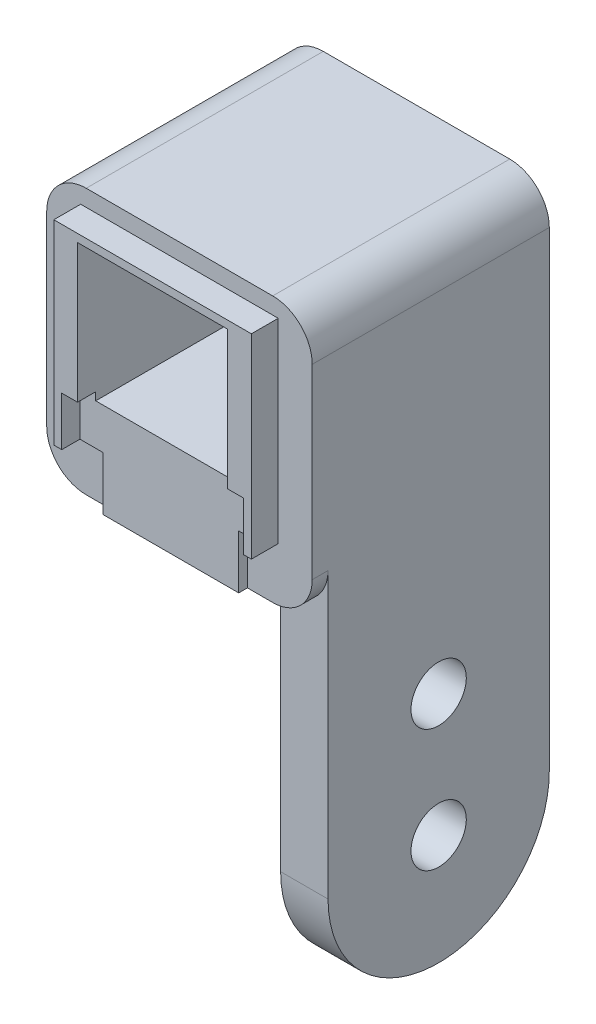
from build123d import *

# Parameters (mm, degrees)
SKETCH1_W           = 25
SKETCH1_H           = 24.7
SKETCH1_W_2         = 19
SKETCH1_H_2         = 18.5
BOSS_EXTRUDE1_DEPTH = 3.4
SKETCH1_3_W         = 33.6
SKETCH1_3_H         = 33.6
SKETCH1_3_W_2       = 19
SKETCH1_3_H_2       = 18.5
BOSS_EXTRUDE2_DEPTH = 27
SKETCH2_W           = 33.6
SKETCH2_H           = 33.6
BOSS_EXTRUDE3_DEPTH = 3
SKETCH3_R           = 3.5
BOSS_EXTRUDE4_DEPTH = 6
FILLET1_R           = 5
SKETCH4_W           = 18
SKETCH4_H           = 5.2
CUT_EXTRUDE1_DEPTH  = 2.3
SKETCH5_W           = 17.2
SKETCH5_H           = 6.8
BOSS_EXTRUDE5_DEPTH = 1.1
SKETCH6_W           = 25
SKETCH6_H           = 6.2
CUT_EXTRUDE2_DEPTH  = 2.3
SKETCH7_W           = 1
SKETCH7_H           = 2.3
BOSS_EXTRUDE6_DEPTH = 6.2


with BuildPart() as part:
    # Sketch1 → Boss-Extrude1 (new body)
    with BuildSketch(Plane.XY):
        with Locations((0.492069479, 3.229581152)):
            Rectangle(SKETCH1_W, SKETCH1_H)
        with Locations((0.492069479, 5.329581152)):
            Rectangle(SKETCH1_W_2, SKETCH1_H_2, mode=Mode.SUBTRACT)
    extrude(amount=BOSS_EXTRUDE1_DEPTH)

    # Sketch1<3> → Boss-Extrude2 (add)
    with BuildSketch(Plane.XY):
        with Locations((0.492069479, 0.879581152)):
            Rectangle(SKETCH1_3_W, SKETCH1_3_H)
        with Locations((0.492069479, 5.329581152)):
            Rectangle(SKETCH1_3_W_2, SKETCH1_3_H_2, mode=Mode.SUBTRACT)
    extrude(amount=-BOSS_EXTRUDE2_DEPTH)

    # Sketch2 → Boss-Extrude3 (add)
    with BuildSketch(Plane(origin=(0, 0, -27), x_dir=(-1, 0, 0), z_dir=(0, 0, -1))):
        with Locations((-0.492069479, 0.879581152)):
            Rectangle(SKETCH2_W, SKETCH2_H)
    extrude(amount=BOSS_EXTRUDE3_DEPTH)

    # Sketch3 → Boss-Extrude4 (add)
    with BuildSketch(Plane(origin=(17.292069479, 0, 0), x_dir=(0, 0, -1), z_dir=(1, 0, 0))):
        with BuildLine():
            Line((30, -46.920418848), (30, -15.920418848))
            Line((30, -15.920418848), (2, -15.920418848))
            Line((2, -15.920418848), (2, -46.920418848))
            ThreePointArc((2, -46.920418848), (16, -60.920418848), (30, -46.920418848))
        make_face()
        with Locations((16, -46.920418848)):
            Circle(SKETCH3_R, mode=Mode.SUBTRACT)
        with Locations((16, -31.420418848)):
            Circle(SKETCH3_R, mode=Mode.SUBTRACT)
    extrude(amount=-BOSS_EXTRUDE4_DEPTH)

    # Fillet1
    fillet1_edges = [part.edges().sort_by_distance(p)[0] for p in [
        (17.292069479, -15.920418848, -1),
        (-16.307930521, -15.920418848, -15),
        (17.292069479, 17.679581152, -15),
        (-16.307930521, 17.679581152, -15),
    ]]
    fillet(fillet1_edges, radius=FILLET1_R)

    # Sketch4 → Cut-Extrude1 (cut)
    with BuildSketch(Plane.XY.offset(3.4)):
        with Locations((0.492069479, -6.520418848)):
            Rectangle(SKETCH4_W, SKETCH4_H)
    extrude(amount=-CUT_EXTRUDE1_DEPTH, mode=Mode.SUBTRACT)

    # Sketch5 → Boss-Extrude5 (add)
    with BuildSketch(Plane.XY):
        with Locations((0.492069479, -12.520418848)):
            Rectangle(SKETCH5_W, SKETCH5_H)
    extrude(amount=BOSS_EXTRUDE5_DEPTH)

    # Sketch6 → Cut-Extrude2 (cut)
    with BuildSketch(Plane.XY.offset(3.4)):
        with Locations((0.492069479, -6.020418848)):
            Rectangle(SKETCH6_W, SKETCH6_H)
    extrude(amount=-CUT_EXTRUDE2_DEPTH, mode=Mode.SUBTRACT)

    # Sketch7 → Boss-Extrude6 (add)
    with BuildSketch(Plane.XZ.offset(2.920418848)):
        with Locations((-11.507930521, 2.25)):
            Rectangle(SKETCH7_W, SKETCH7_H)
        with Locations((12.492069479, 2.25)):
            Rectangle(SKETCH7_W, SKETCH7_H)
    extrude(amount=BOSS_EXTRUDE6_DEPTH)


solid = part.part
